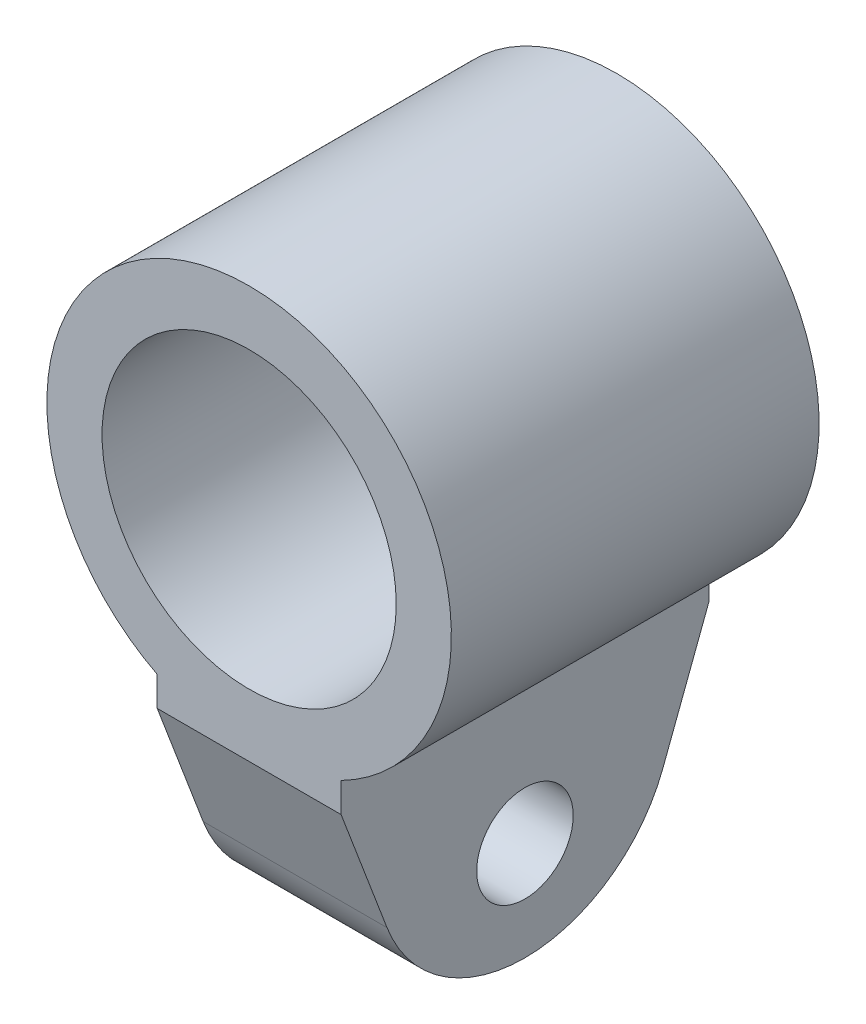
from build123d import *

# Parameters (mm, degrees)
SKETCH1_R                = 22
SKETCH1_R_2              = 16
BOSS_EXTRUDE1_DEPTH      = 20
BOSS_EXTRUDE2_REACH      = 55.774
BOSS_EXTRUDE2_END_RADIUS = 22
SKETCH5_W                = 20
SKETCH5_H                = 40
SKETCH6_R                = 5.25
BOSS_EXTRUDE3_DEPTH      = 10


with BuildPart() as part:
    # Sketch1 → Boss-Extrude1 (new, symmetric)
    with BuildSketch(Plane.XY):
        with Locations((0, 41.80685414)):
            Circle(SKETCH1_R)
        with Locations((0, 41.80685414)):
            Circle(SKETCH1_R_2, mode=Mode.SUBTRACT)
    extrude(amount=BOSS_EXTRUDE1_DEPTH, both=True)

    # Boss-Extrude2: up to this cylinder (the profile starts outside it)
    boss_extrude2_end = Plane(origin=(0, 41.80685414, 0), z_dir=(0, 0, -1)) * Cylinder(BOSS_EXTRUDE2_END_RADIUS, 156.548, mode=Mode.PRIVATE)
    # Sketch5 → Boss-Extrude2 (add, up to the surface)
    with BuildSketch(Plane(origin=(0, 19, 0), x_dir=(1, 0, 0), z_dir=(0, 1, 0)), mode=Mode.PRIVATE) as boss_extrude2_sk1:
        Rectangle(SKETCH5_W, SKETCH5_H)
    boss_extrude2_tool1 = extrude(boss_extrude2_sk1.sketch, amount=BOSS_EXTRUDE2_REACH, mode=Mode.PRIVATE) - boss_extrude2_end
    add(boss_extrude2_tool1.solids().sort_by_distance((0, 19, 0))[0])

    # Sketch6 → Boss-Extrude3 (add, symmetric)
    with BuildSketch(Plane(origin=(0, 0, 0), x_dir=(0, 0, -1), z_dir=(1, 0, 0))):
        with BuildLine():
            Line((-20, 19), (-15, 5.842729547))
            ThreePointArc((-15, 5.842729547), (0, -4.503591016), (15, 5.842729547))
            Line((15, 5.842729547), (20, 19))
            Line((20, 19), (-20, 19))
        make_face()
        with Locations((0, 6.293)):
            Circle(SKETCH6_R, mode=Mode.SUBTRACT)
    extrude(amount=BOSS_EXTRUDE3_DEPTH, both=True)


solid = part.part
